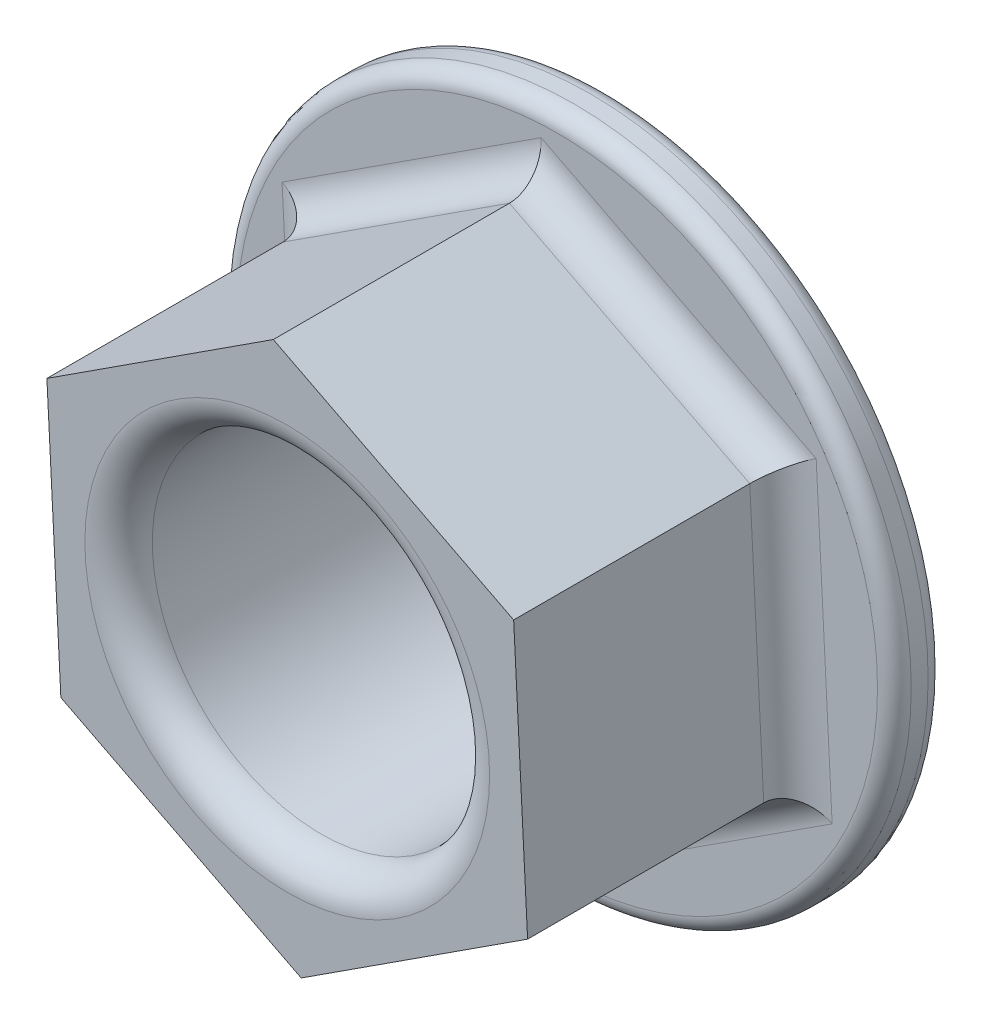
from build123d import *

# Parameters (mm, degrees)
SKETCH1_R           = 10
BOSS_EXTRUDE2_DEPTH = 1.5
FILLET1_R           = 0.5
BOSS_EXTRUDE3_DEPTH = 8
FILLET2_R           = 1
SKETCH5_R           = 5
CUT_EXTRUDE1_DEPTH  = 18.036725155
FILLET3_R           = 1


with BuildPart() as part:
    # Sketch1 → Boss-Extrude2 (new body)
    with BuildSketch(Plane.XY):
        Circle(SKETCH1_R)
    extrude(amount=BOSS_EXTRUDE2_DEPTH)

    # Fillet1
    fillet1_edges = [part.edges().sort_by_distance(p)[0] for p in [
        (-10, 0, 0),
        (-10, 0, 1.5),
    ]]
    fillet(fillet1_edges, radius=FILLET1_R)

    # Sketch3 → Boss-Extrude3 (add)
    with BuildSketch(Plane.XY.offset(1.5)):
        Polygon((-7.125875884, 3.636192085), (-6.711972661, -4.353093498), (0.413903224, -7.989285583), (7.125875884, -3.636192085), (6.711972661, 4.353093498), (-0.413903224, 7.989285583), align=None)
    extrude(amount=BOSS_EXTRUDE3_DEPTH)

    # Fillet2
    fillet2_edges = [part.edges().sort_by_distance(p)[0] for p in [
        (-3.149034719, -6.17118954, 1.5),
        (-6.918924273, -0.358450706, 1.5),
        (-3.769889554, 5.812738834, 1.5),
        (3.149034719, 6.17118954, 1.5),
        (6.918924273, 0.358450706, 1.5),
        (3.769889554, -5.812738834, 1.5),
    ]]
    fillet(fillet2_edges, radius=FILLET2_R)

    # Sketch5 → Cut-Extrude1 (cut, through all)
    with BuildSketch(Plane.XY.offset(9.5)):
        Circle(SKETCH5_R)
    extrude(amount=-CUT_EXTRUDE1_DEPTH, mode=Mode.SUBTRACT)

    # Fillet3
    fillet3_edges = [part.edges().sort_by_distance(p)[0] for p in [
        (-5, 0, 9.5),
        (-5, 0, 0),
    ]]
    fillet(fillet3_edges, radius=FILLET3_R)


solid = part.part
